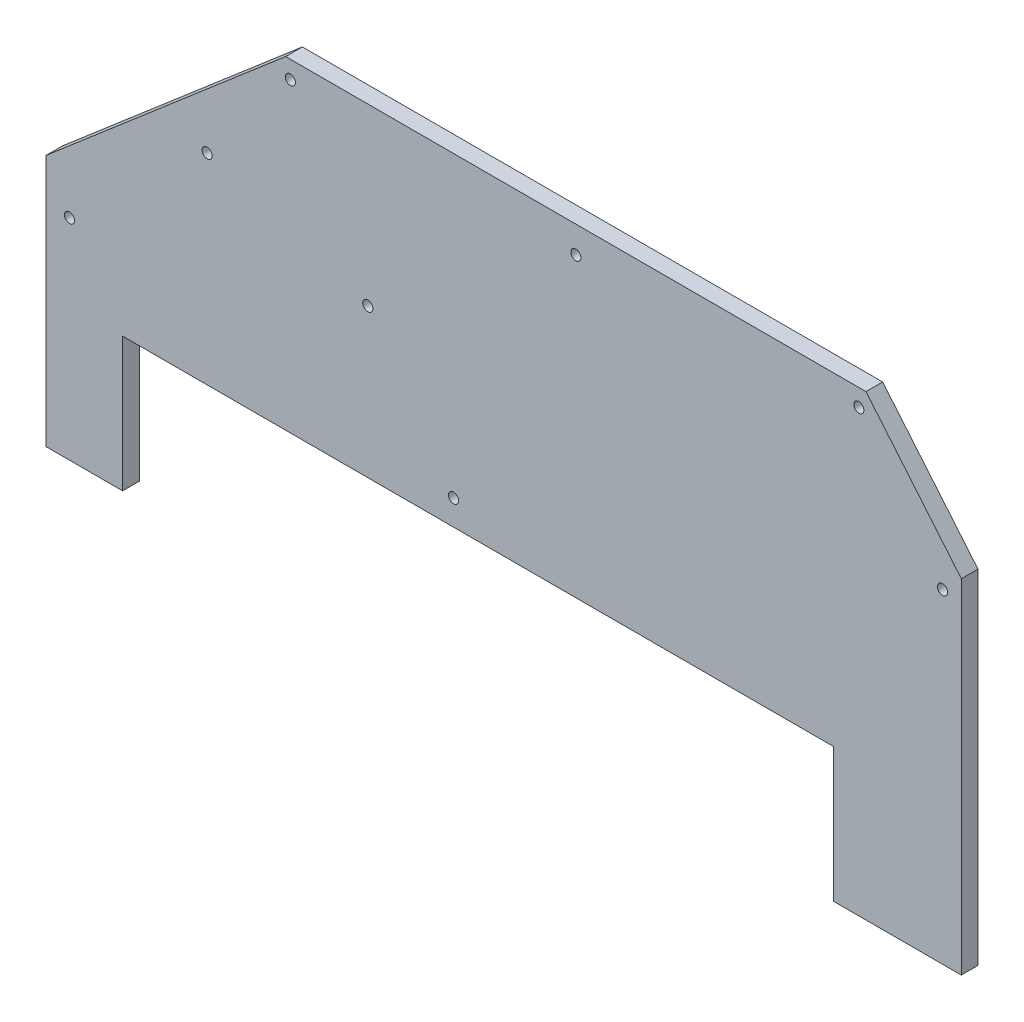
from build123d import *

# Parameters (mm, degrees)
SKETCH1_R               = 3.3782
BOSS_EXTRUDE1_DEPTH     = 11.1125
SKETCH2_R               = 3.3655
CUT_EXTRUDE1_DEPTH      = 421.288113218
SKETCH3_R               = 3.3655
CUT_EXTRUDE2_DEPTH      = 421.177767573
SKETCH4_R               = 3.3655
CUT_EXTRUDE3_DEPTH      = 421.177767573
SKETCH5_R               = 3.3655
CUT_EXTRUDE4_DEPTH      = 421.177767573
CUT_EXTRUDE5_DEPTH      = 421.393634125
CUT_EXTRUDE5_DEPTH_BACK = 421.393634125
SKETCH6_R               = 3.3782
SKETCH7_W               = 18.18
SKETCH7_H               = 167.982857143
CUT_EXTRUDE6_DEPTH      = 693.582490434


with BuildPart() as part:
    # Sketch1 → Boss-Extrude1 (new body)
    with BuildSketch(Plane.XY):
        Polygon((-558.565, 76.762), (-458.235, 76.762), (-140.853700004, 76.762), (-84.973700004, 76.762), (-84.973700004, -12.5), (0, -12.5), (0, 216.1), (-63.5, 292.3), (-449.98, 292.3), (-627.78, 139.9), (-627.78, -12.5), (-558.565, -12.5), align=None)
        with Locations((-12.5, 203.6)):
            Circle(SKETCH1_R, mode=Mode.SUBTRACT)
    extrude(amount=BOSS_EXTRUDE1_DEPTH)

    # Sketch2 → Cut-Extrude1 (cut, through all)
    with BuildSketch(Plane(origin=(-305, 23.6125, -5.08), x_dir=(-1, 0, 0), z_dir=(0, 0, -1))):
        with Locations((288.9533823, 103.7145)):
            Circle(SKETCH2_R)
    extrude(amount=-CUT_EXTRUDE1_DEPTH, mode=Mode.SUBTRACT)

    # Sketch3 → Cut-Extrude2 (cut, through all)
    with BuildSketch(Plane(origin=(-305, 23.6125, -1.905), x_dir=(-1, 0, 0), z_dir=(0, 0, -1))):
        with Locations((141.846254523, 256.904809604)):
            Circle(SKETCH3_R)
    extrude(amount=-CUT_EXTRUDE2_DEPTH, mode=Mode.SUBTRACT)

    # Sketch4 → Cut-Extrude3 (cut, through all)
    with BuildSketch(Plane(origin=(-305, 23.6125, -1.905), x_dir=(-1, 0, 0), z_dir=(0, 0, -1))):
        with Locations((-48.26, 250.9075)):
            Circle(SKETCH4_R)
    extrude(amount=-CUT_EXTRUDE3_DEPTH, mode=Mode.SUBTRACT)

    # Sketch5 → Cut-Extrude4 (cut, through all)
    with BuildSketch(Plane(origin=(-305, 23.6125, -1.905), x_dir=(-1, 0, 0), z_dir=(0, 0, -1))):
        with Locations((-236.766660116, 257.207608298)):
            Circle(SKETCH5_R)
    extrude(amount=-CUT_EXTRUDE4_DEPTH, mode=Mode.SUBTRACT)

    # Sketch6 → Cut-Extrude5 (cut, two sides: drawn at the far end of the back side and taken through both)
    with BuildSketch(Plane(origin=(-305, 23.6125, 18.7325), x_dir=(1, 0, 0), z_dir=(0, 0, 1)).offset(-CUT_EXTRUDE5_DEPTH_BACK)):
        with Locations((-197.262125611, 186.926969688)):
            Circle(SKETCH6_R)
        with Locations((-33.209654284, 70.005387803)):
            Circle(SKETCH6_R)
        with Locations((-90.296950895, 152.235012548)):
            Circle(SKETCH6_R)
    extrude(amount=CUT_EXTRUDE5_DEPTH + CUT_EXTRUDE5_DEPTH_BACK, mode=Mode.SUBTRACT)

    # Sketch7 → Cut-Extrude6 (cut, through all)
    with BuildSketch(Plane.XY.offset(11.1125)):
        with Locations((-618.69, 71.491428572)):
            Rectangle(SKETCH7_W, SKETCH7_H)
    extrude(amount=-CUT_EXTRUDE6_DEPTH, mode=Mode.SUBTRACT)


solid = part.part
